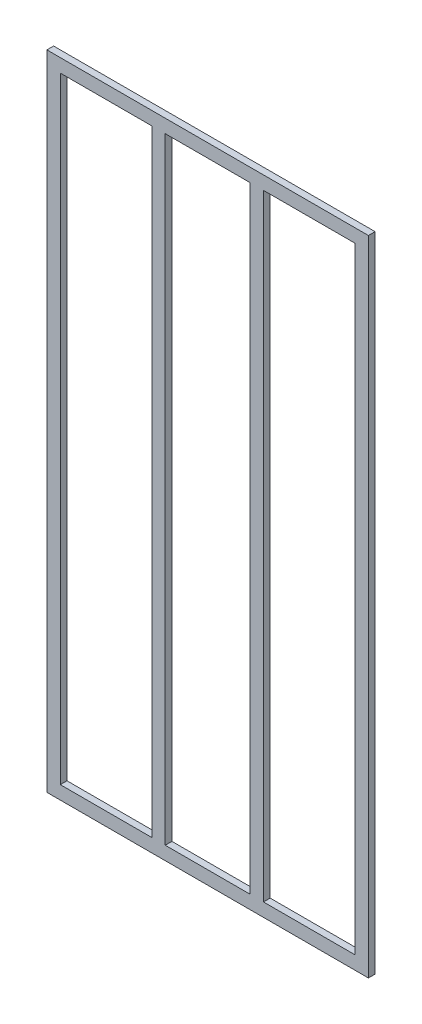
from build123d import *

# Parameters (mm, degrees)
CROQUIS1_W              = 1220
CROQUIS1_H              = 2440
CROQUIS1_W_2            = 1118.4
CROQUIS1_H_2            = 2338.4
SALIENTE_EXTRUIR1_DEPTH = 25.4
CROQUIS2_W              = 50.8
CROQUIS2_H              = 2338.4
SALIENTE_EXTRUIR2_DEPTH = 25.4


with BuildPart() as part:
    # Croquis1 → Saliente-Extruir1 (new body)
    with BuildSketch(Plane.XY):
        Rectangle(CROQUIS1_W, CROQUIS1_H)
        Rectangle(CROQUIS1_W_2, CROQUIS1_H_2, mode=Mode.SUBTRACT)
    extrude(amount=SALIENTE_EXTRUIR1_DEPTH)

    # Croquis2 → Saliente-Extruir2 (add)
    with BuildSketch(Plane.XY.offset(25.4)):
        with Locations((-186.4, 0)):
            Rectangle(CROQUIS2_W, CROQUIS2_H)
        with Locations((186.4, 0)):
            Rectangle(CROQUIS2_W, CROQUIS2_H)
    extrude(amount=-SALIENTE_EXTRUIR2_DEPTH)


solid = part.part
